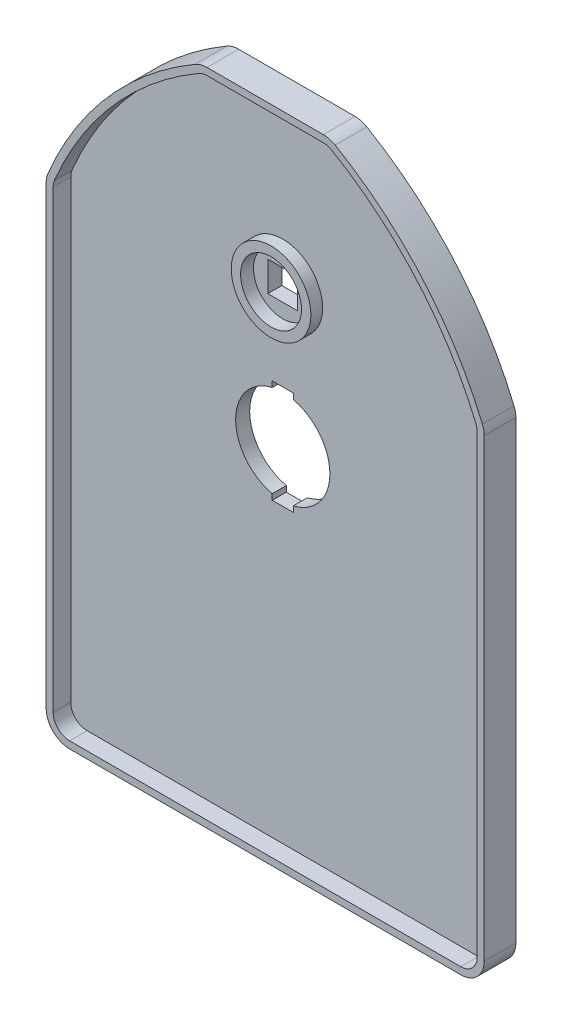
from build123d import *

# Parameters (mm, degrees)
BOSS_EXTRUDE1_DEPTH = 2.4
EXTRUDE_THIN1_DEPTH = 3
SKETCH3_R           = 8.05
CUT_EXTRUDE1_DEPTH  = 71.680761173
SKETCH4_R           = 5.2
SKETCH4_R_2         = 5
CUT_EXTRUDE2_DEPTH  = 0.8
SKETCH5_W           = 5.1
SKETCH5_H           = 5.1
SKETCH5_W_2         = 4.8
SKETCH5_H_2         = 4.8
CUT_EXTRUDE5_DEPTH  = 71.823230652
BOSS_EXTRUDE2_START = 2
SKETCH8_R           = 6.8
SKETCH8_R_2         = 5.2
BOSS_EXTRUDE2_DEPTH = 2


with BuildPart() as part:
    # Sketch1 → Boss-Extrude1 (new body)
    with BuildSketch(Plane.XY):
        with BuildLine():
            Line((37.4, -55.9), (37.4, 21.822390499))
            ThreePointArc((37.4, 21.822390499), (37.321949444, 22.608719027), (37.090843722, 23.364360867))
            ThreePointArc((37.090843722, 23.364360867), (26.864407476, 39.766080063), (11.953879914, 52.065371047))
            ThreePointArc((11.953879914, 52.065371047), (10.982508971, 52.471443007), (9.938833779, 52.61))
            Line((9.938833779, 52.61), (-9.938833779, 52.61))
            ThreePointArc((-9.938833779, 52.61), (-10.982508971, 52.471443007), (-11.953879914, 52.065371047))
            ThreePointArc((-11.953879914, 52.065371047), (-26.864407476, 39.766080063), (-37.090843722, 23.364360867))
            ThreePointArc((-37.090843722, 23.364360867), (-37.321949444, 22.608719027), (-37.4, 21.822390499))
            Line((-37.4, 21.822390499), (-37.4, -55.9))
            ThreePointArc((-37.4, -55.9), (-36.228427125, -58.728427125), (-33.4, -59.9))
            Line((-33.4, -59.9), (33.4, -59.9))
            ThreePointArc((33.4, -59.9), (36.228427125, -58.728427125), (37.4, -55.9))
        make_face()
    extrude(amount=BOSS_EXTRUDE1_DEPTH)

    # Sketch2 → Extrude-Thin1 (add)
    with BuildSketch(Plane.XY.offset(2.4)):
        with BuildLine():
            Line((37.4, -55.9), (37.4, 21.822390499))
            ThreePointArc((37.4, 21.822390499), (37.321949444, 22.608719027), (37.090843722, 23.364360867))
            ThreePointArc((37.090843722, 23.364360867), (26.864407476, 39.766080063), (11.953879914, 52.065371047))
            ThreePointArc((11.953879914, 52.065371047), (10.982508971, 52.471443007), (9.938833779, 52.61))
            Line((9.938833779, 52.61), (-9.938833779, 52.61))
            ThreePointArc((-9.938833779, 52.61), (-10.982508971, 52.471443007), (-11.953879914, 52.065371047))
            ThreePointArc((-11.953879914, 52.065371047), (-26.864407476, 39.766080063), (-37.090843722, 23.364360867))
            ThreePointArc((-37.090843722, 23.364360867), (-37.321949444, 22.608719027), (-37.4, 21.822390499))
            Line((-37.4, 21.822390499), (-37.4, -55.9))
            ThreePointArc((-37.4, -55.9), (-36.228427125, -58.728427125), (-33.4, -59.9))
            Line((-33.4, -59.9), (33.4, -59.9))
            ThreePointArc((33.4, -59.9), (36.228427125, -58.728427125), (37.4, -55.9))
        make_face()
        with BuildLine():
            Line((36.2, -55.9), (36.2, 21.822390499))
            ThreePointArc((36.2, 21.822390499), (36.145364611, 22.372820469), (35.983590606, 22.901769756))
            ThreePointArc((35.983590606, 22.901769756), (25.961683084, 38.975454569), (11.349366074, 51.028759733))
            ThreePointArc((11.349366074, 51.028759733), (10.669406413, 51.313010105), (9.938833779, 51.41))
            Line((9.938833779, 51.41), (-9.938833779, 51.41))
            ThreePointArc((-9.938833779, 51.41), (-10.669406413, 51.313010105), (-11.349366074, 51.028759733))
            ThreePointArc((-11.349366074, 51.028759733), (-25.961683084, 38.975454569), (-35.983590606, 22.901769756))
            ThreePointArc((-35.983590606, 22.901769756), (-36.145364611, 22.372820469), (-36.2, 21.822390499))
            Line((-36.2, 21.822390499), (-36.2, -55.9))
            ThreePointArc((-36.2, -55.9), (-35.379898987, -57.879898987), (-33.4, -58.7))
            Line((-33.4, -58.7), (33.4, -58.7))
            ThreePointArc((33.4, -58.7), (35.379898987, -57.879898987), (36.2, -55.9))
        make_face(mode=Mode.SUBTRACT)
    extrude(amount=EXTRUDE_THIN1_DEPTH)

    # Sketch3 → Cut-Extrude1 (cut, through all)
    with BuildSketch(Plane.XY.offset(2.4)):
        with BuildLine():
            Line((1.8, 8.8223931), (-1.8, 8.8223931))
            Line((-1.8, 8.8223931), (-1.8, 7.846177413))
            ThreePointArc((-1.8, 7.846177413), (0, 8.05), (1.8, 7.846177413))
            Line((1.8, 7.846177413), (1.8, 8.8223931))
        make_face()
        with BuildLine():
            ThreePointArc((1.8, -7.846177413), (0, -8.05), (-1.8, -7.846177413))
            Line((-1.8, -7.846177413), (-1.8, -8.8223931))
            Line((-1.8, -8.8223931), (1.8, -8.8223931))
            Line((1.8, -8.8223931), (1.8, -7.846177413))
        make_face()
        Circle(SKETCH3_R)
    extrude(amount=-CUT_EXTRUDE1_DEPTH, mode=Mode.SUBTRACT)

    # Sketch4 → Cut-Extrude2 (cut)
    with BuildSketch(Plane.XY.offset(2.4)):
        with Locations((0, 23.9)):
            Circle(SKETCH4_R)
        with Locations((0, 23.9)):
            Circle(SKETCH4_R_2, mode=Mode.SUBTRACT)
    extrude(amount=-CUT_EXTRUDE2_DEPTH, mode=Mode.SUBTRACT)

    # Sketch5 → Cut-Extrude5 (cut, through all)
    # profile 1 of 2: a face of its own
    with BuildSketch(Plane(origin=(0, 0, 0), x_dir=(-1, 0, 0), z_dir=(0, 0, -1))):
        with Locations((0, 23.9)):
            Rectangle(SKETCH5_W, SKETCH5_H)
        with Locations((0, 23.9)):
            Rectangle(SKETCH5_W_2, SKETCH5_H_2, mode=Mode.SUBTRACT)
    # profile 2 of 2: a face of its own
    with BuildSketch(Plane(origin=(0, 0, 0), x_dir=(-1, 0, 0), z_dir=(0, 0, -1))):
        with Locations((0, 23.9)):
            Rectangle(SKETCH5_W_2, SKETCH5_H_2)
    extrude(amount=-CUT_EXTRUDE5_DEPTH, mode=Mode.SUBTRACT)

    # Sketch8 → Boss-Extrude2 (add)
    with BuildSketch(Plane.XY.offset(2.4).offset(BOSS_EXTRUDE2_START)):
        with Locations((0, 23.9)):
            Circle(SKETCH8_R)
        with Locations((0, 23.9)):
            Circle(SKETCH8_R_2, mode=Mode.SUBTRACT)
    extrude(amount=-BOSS_EXTRUDE2_DEPTH)


solid = part.part
